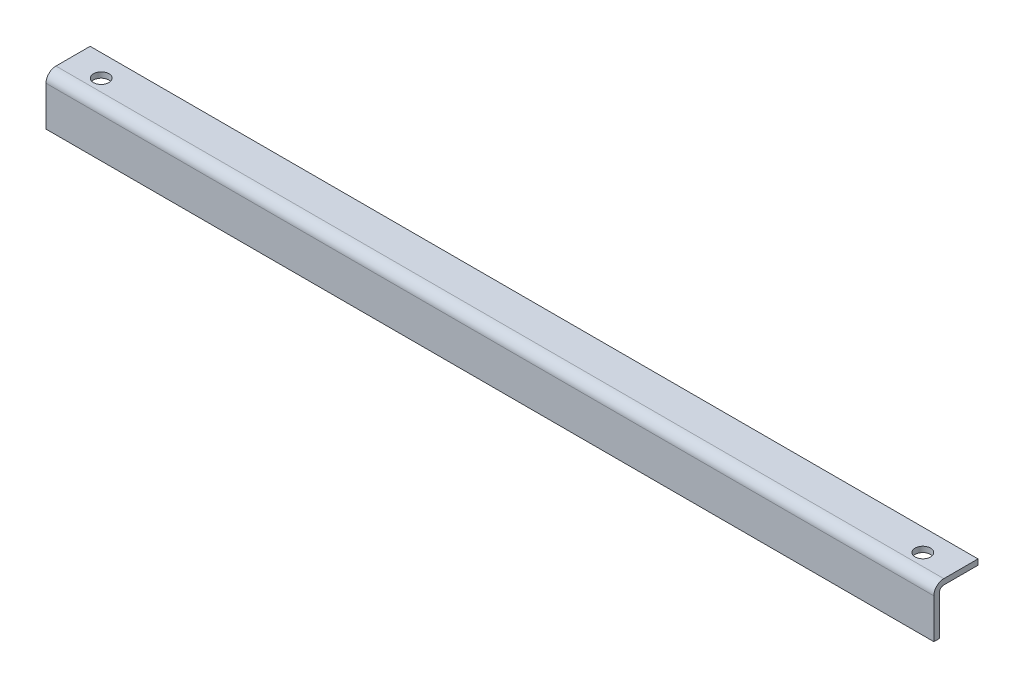
from build123d import *

# Parameters (mm, degrees)
SKETCH1_W           = 402.26222862
SKETCH1_H           = 20
BOSS_EXTRUDE1_DEPTH = 2.5
SKETCH2_R           = 3.5
CUT_EXTRUDE1_DEPTH  = 2.5
SKETCH3_W           = 402.26222862
SKETCH3_H           = 2.5
BOSS_EXTRUDE2_DEPTH = 20
FILLET1_R           = 2
FILLET2_R           = 4.5


with BuildPart() as part:
    # Sketch1 → Boss-Extrude1 (new body)
    with BuildSketch(Plane(origin=(0, 0, 0), x_dir=(1, 0, 0), z_dir=(0, 1, 0))):
        Rectangle(SKETCH1_W, SKETCH1_H)
    extrude(amount=BOSS_EXTRUDE1_DEPTH)

    # Sketch2 → Cut-Extrude1 (cut)
    with BuildSketch(Plane(origin=(0, 2.5, 0), x_dir=(1, 0, 0), z_dir=(0, 1, 0))):
        with Locations(Location((186.13111431, 0, 0), (0, 0, 270))):
            Circle(SKETCH2_R)
        with Locations(Location((-186.13111431, 0, 0), (0, 0, 270))):
            Circle(SKETCH2_R)
    extrude(amount=-CUT_EXTRUDE1_DEPTH, mode=Mode.SUBTRACT)

    # Sketch3 → Boss-Extrude2 (add)
    with BuildSketch(Plane.XZ):
        with Locations((0, 8.75)):
            Rectangle(SKETCH3_W, SKETCH3_H)
    extrude(amount=BOSS_EXTRUDE2_DEPTH)

    # Fillet1
    fillet1_edges = [part.edges().sort_by_distance(p)[0] for p in [
        (0, 0, 7.5),
    ]]
    fillet(fillet1_edges, radius=FILLET1_R)

    # Fillet2
    fillet2_edges = [part.edges().sort_by_distance(p)[0] for p in [
        (0, 2.5, 10),
    ]]
    fillet(fillet2_edges, radius=FILLET2_R)


solid = part.part
